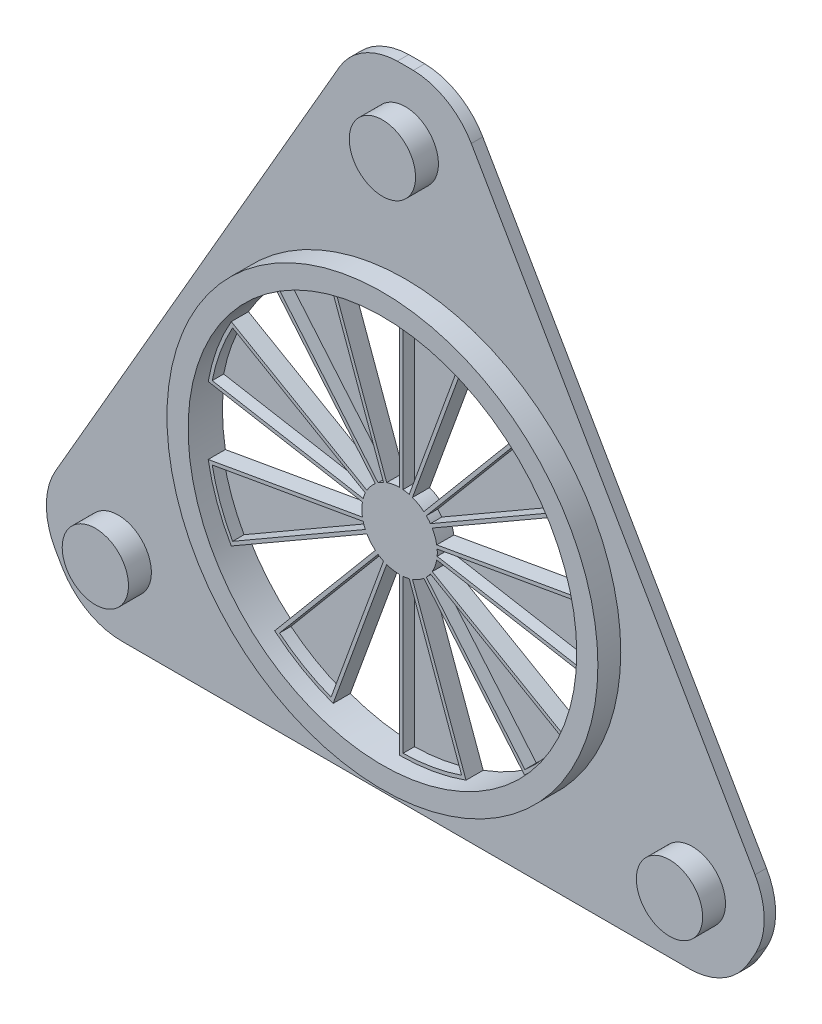
from build123d import *
from build123d.topology import SkipClean

# Parameters (mm, degrees)
SKETCH2_R           = 18.85
BOSS_EXTRUDE1_DEPTH = 3
BOSS_EXTRUDE7_START = -0.5
BOSS_EXTRUDE7_DEPTH = 0.5
BOSS_EXTRUDE9_START = -2
SKETCH17_R          = 3.3
BOSS_EXTRUDE9_DEPTH = 2
SKETCH9_R           = 3.098061326
BOSS_EXTRUDE5_DEPTH = 3
BOSS_EXTRUDE2_START = -1
SKETCH3_R           = 35
SKETCH3_R_2         = 18.85
BOSS_EXTRUDE2_DEPTH = 1
SKETCH4_R           = 2.9
BOSS_EXTRUDE3_DEPTH = 3
SKETCH6_R           = 5
BOSS_EXTRUDE4_DEPTH = 1
SKETCH7_R           = 59.131365533
CUT_EXTRUDE1_DEPTH  = 10
FILLET1_R           = 6
SKETCH19_R          = 17
CUT_EXTRUDE3_DEPTH  = 1.5


with BuildPart() as part:
    # Sketch2 → Boss-Extrude1 (new body)
    # profile 1 of 37: a face of its own
    with BuildSketch(Plane.XY.offset(10)):
        Circle(SKETCH2_R)
        with BuildLine():
            ThreePointArc((-5.814342437, 15.974774553), (-2.95201902, 16.741731801), (0, 17))
            ThreePointArc((0, 17), (2.95201902, 16.741731801), (5.814342437, 15.974774553))
            ThreePointArc((5.814342437, 15.974774553), (8.5, 14.722431864), (10.927389365, 13.022755533))
            ThreePointArc((10.927389365, 13.022755533), (13.022755533, 10.927389365), (14.722431864, 8.5))
            ThreePointArc((14.722431864, 8.5), (15.974774553, 5.814342437), (16.741731801, 2.95201902))
            ThreePointArc((16.741731801, 2.95201902), (16.935309868, 1.481647627), (17, 0))
            ThreePointArc((17, 0), (16.935309868, -1.481647627), (16.741731801, -2.95201902))
            ThreePointArc((16.741731801, -2.95201902), (15.974774553, -5.814342437), (14.722431864, -8.5))
            ThreePointArc((14.722431864, -8.5), (13.022755533, -10.927389365), (10.927389365, -13.022755533))
            ThreePointArc((10.927389365, -13.022755533), (8.5, -14.722431864), (5.814342437, -15.974774553))
            ThreePointArc((5.814342437, -15.974774553), (2.95201902, -16.741731801), (0, -17))
            ThreePointArc((0, -17), (-2.95201902, -16.741731801), (-5.814342437, -15.974774553))
            ThreePointArc((-5.814342437, -15.974774553), (-8.5, -14.722431864), (-10.927389365, -13.022755533))
            ThreePointArc((-10.927389365, -13.022755533), (-13.022755533, -10.927389365), (-14.722431864, -8.5))
            ThreePointArc((-14.722431864, -8.5), (-15.974774553, -5.814342437), (-16.741731801, -2.95201902))
            ThreePointArc((-16.741731801, -2.95201902), (-17, 0), (-16.741731801, 2.95201902))
            ThreePointArc((-16.741731801, 2.95201902), (-15.974774553, 5.814342437), (-14.722431864, 8.5))
            ThreePointArc((-14.722431864, 8.5), (-13.022755533, 10.927389365), (-10.927389365, 13.022755533))
            ThreePointArc((-10.927389365, 13.022755533), (-8.5, 14.722431864), (-5.814342437, 15.974774553))
        make_face(mode=Mode.SUBTRACT)
    # profile 2 of 37: a face of its own
    with BuildSketch(Plane.XY.offset(10)):
        with BuildLine():
            Line((0, 17), (0, 16.697537549))
            ThreePointArc((0, 16.697537549), (0.150006053, 16.696863729), (0.3, 16.694842323))
            ThreePointArc((0.3, 16.694842323), (2.899496967, 16.443864434), (5.428064578, 15.790626179))
            ThreePointArc((5.428064578, 15.790626179), (5.569704144, 15.741224728), (5.710894186, 15.69055282))
            Line((5.710894186, 15.69055282), (5.814342437, 15.974774553))
            ThreePointArc((5.814342437, 15.974774553), (2.95201902, 16.741731801), (0, 17))
        make_face()
    # profile 3 of 37: a face of its own
    with BuildSketch(Plane.XY.offset(10)):
        with BuildLine():
            ThreePointArc((-5.99188015, 15.585414093), (-5.851623307, 15.638614544), (-5.710894186, 15.69055282))
            Line((-5.710894186, 15.69055282), (-5.814342437, 15.974774553))
            ThreePointArc((-5.814342437, 15.974774553), (-8.5, 14.722431864), (-10.927389365, 13.022755533))
            Line((-10.927389365, 13.022755533), (-10.732970249, 12.791055853))
            ThreePointArc((-10.732970249, 12.791055853), (-10.617625822, 12.886961709), (-10.501424458, 12.981827473))
            ThreePointArc((-10.501424458, 12.981827473), (-8.348768774, 14.460491698), (-5.99188015, 15.585414093))
        make_face()
    # profile 4 of 37: a face of its own
    with BuildSketch(Plane.XY.offset(10)):
        with BuildLine():
            ThreePointArc((-14.608157564, 8.08761354), (-14.534911179, 8.218522811), (-14.460491698, 8.348768774))
            Line((-14.460491698, 8.348768774), (-14.722431864, 8.5))
            ThreePointArc((-14.722431864, 8.5), (-15.974774553, 5.814342437), (-16.741731801, 2.95201902))
            Line((-16.741731801, 2.95201902), (-16.443864434, 2.899496967))
            ThreePointArc((-16.443864434, 2.899496967), (-16.417152573, 3.047107084), (-16.389115702, 3.194471272))
            ThreePointArc((-16.389115702, 3.194471272), (-15.69055282, 5.710894186), (-14.608157564, 8.08761354))
        make_face()
    # profile 5 of 37: a face of its own
    with BuildSketch(Plane.XY.offset(10)):
        with BuildLine():
            ThreePointArc((-16.389115702, -3.194471272), (-16.417152573, -3.047107084), (-16.443864434, -2.899496967))
            Line((-16.443864434, -2.899496967), (-16.741731801, -2.95201902))
            ThreePointArc((-16.741731801, -2.95201902), (-15.974774553, -5.814342437), (-14.722431864, -8.5))
            Line((-14.722431864, -8.5), (-14.460491698, -8.348768774))
            ThreePointArc((-14.460491698, -8.348768774), (-14.534911179, -8.218522811), (-14.608157564, -8.08761354))
            ThreePointArc((-14.608157564, -8.08761354), (-15.69055282, -5.710894186), (-16.389115702, -3.194471272))
        make_face()
    # profile 6 of 37: a face of its own
    with BuildSketch(Plane.XY.offset(10)):
        with BuildLine():
            ThreePointArc((-10.501424458, -12.981827473), (-10.617625822, -12.886961709), (-10.732970249, -12.791055853))
            Line((-10.732970249, -12.791055853), (-10.927389365, -13.022755533))
            ThreePointArc((-10.927389365, -13.022755533), (-8.5, -14.722431864), (-5.814342437, -15.974774553))
            Line((-5.814342437, -15.974774553), (-5.710894186, -15.69055282))
            ThreePointArc((-5.710894186, -15.69055282), (-5.851623307, -15.638614544), (-5.99188015, -15.585414093))
            ThreePointArc((-5.99188015, -15.585414093), (-8.348768774, -14.460491698), (-10.501424458, -12.981827473))
        make_face()
    # profile 7 of 37: a face of its own
    with BuildSketch(Plane.XY.offset(10)):
        with BuildLine():
            Line((5.814342437, -15.974774553), (5.710894186, -15.69055282))
            ThreePointArc((5.710894186, -15.69055282), (5.569704144, -15.741224728), (5.428064578, -15.790626179))
            ThreePointArc((5.428064578, -15.790626179), (2.899496967, -16.443864434), (0.3, -16.694842323))
            ThreePointArc((0.3, -16.694842323), (0.150006053, -16.696863729), (0, -16.697537549))
            Line((0, -16.697537549), (0, -17))
            ThreePointArc((0, -17), (2.95201902, -16.741731801), (5.814342437, -15.974774553))
        make_face()
    # profile 8 of 37: a face of its own
    with BuildSketch(Plane.XY.offset(10)):
        with BuildLine():
            Line((14.722431864, -8.5), (14.460491698, -8.348768774))
            ThreePointArc((14.460491698, -8.348768774), (14.384905126, -8.478340917), (14.308157564, -8.607228783))
            ThreePointArc((14.308157564, -8.607228783), (12.791055853, -10.732970249), (10.961051124, -12.596154907))
            ThreePointArc((10.961051124, -12.596154907), (10.847448429, -12.694117644), (10.732970249, -12.791055853))
            Line((10.732970249, -12.791055853), (10.927389365, -13.022755533))
            ThreePointArc((10.927389365, -13.022755533), (13.022755533, -10.927389365), (14.722431864, -8.5))
        make_face()
    # profile 9 of 37: a face of its own
    with BuildSketch(Plane.XY.offset(10)):
        with BuildLine():
            ThreePointArc((0.842085099, 3.190751116), (0.986397435, 3.149130054), (1.128666473, 3.100985649))
            Line((1.128666473, 3.100985649), (5.710894186, 15.69055282))
            ThreePointArc((5.710894186, 15.69055282), (5.569704144, 15.741224728), (5.428064578, 15.790626179))
            Line((5.428064578, 15.790626179), (0.842085099, 3.190751116))
        make_face()
    # profile 10 of 37: a face of its own
    with BuildSketch(Plane.XY.offset(10)):
        with BuildLine():
            Line((0, 16.697537549), (0, 3.3))
            ThreePointArc((0, 3.3), (0.150155522, 3.296582066), (0.3, 3.286335345))
            Line((0.3, 3.286335345), (0.3, 16.694842323))
            ThreePointArc((0.3, 16.694842323), (0.150006053, 16.696863729), (0, 16.697537549))
        make_face()
    # profile 11 of 37: a face of its own
    with BuildSketch(Plane.XY.offset(10)):
        with BuildLine():
            ThreePointArc((-1.405900672, 2.98553903), (-1.268597506, 3.046417628), (-1.128666473, 3.100985649))
            Line((-1.128666473, 3.100985649), (-5.710894186, 15.69055282))
            ThreePointArc((-5.710894186, 15.69055282), (-5.851623307, 15.638614544), (-5.99188015, 15.585414093))
            Line((-5.99188015, 15.585414093), (-1.405900672, 2.98553903))
        make_face()
    # profile 12 of 37: a face of its own
    with BuildSketch(Plane.XY.offset(10)):
        with BuildLine():
            Line((-10.732970249, 12.791055853), (-2.121199112, 2.527946662))
            ThreePointArc((-2.121199112, 2.527946662), (-2.003976303, 2.621846482), (-1.882602308, 2.710315212))
            Line((-1.882602308, 2.710315212), (-10.501424458, 12.981827473))
            ThreePointArc((-10.501424458, 12.981827473), (-10.617625822, 12.886961709), (-10.732970249, 12.791055853))
        make_face()
    # profile 13 of 37: a face of its own
    with BuildSketch(Plane.XY.offset(10)):
        with BuildLine():
            ThreePointArc((-2.996049894, 1.383360051), (-2.930001576, 1.518252537), (-2.857883832, 1.65))
            Line((-2.857883832, 1.65), (-14.460491698, 8.348768774))
            ThreePointArc((-14.460491698, 8.348768774), (-14.534911179, 8.218522811), (-14.608157564, 8.08761354))
            Line((-14.608157564, 8.08761354), (-2.996049894, 1.383360051))
        make_face()
    # profile 14 of 37: a face of its own
    with BuildSketch(Plane.XY.offset(10)):
        with BuildLine():
            Line((-16.443864434, 2.899496967), (-3.249865585, 0.573038986))
            ThreePointArc((-3.249865585, 0.573038986), (-3.220425345, 0.72031979), (-3.184314073, 0.86610847))
            Line((-3.184314073, 0.86610847), (-16.389115702, 3.194471272))
            ThreePointArc((-16.389115702, 3.194471272), (-16.417152573, 3.047107084), (-16.443864434, 2.899496967))
        make_face()
    # profile 15 of 37: a face of its own
    with BuildSketch(Plane.XY.offset(10)):
        with BuildLine():
            ThreePointArc((-3.184314073, -0.86610847), (-3.220425345, -0.72031979), (-3.249865585, -0.573038986))
            Line((-3.249865585, -0.573038986), (-16.443864434, -2.899496967))
            ThreePointArc((-16.443864434, -2.899496967), (-16.417152573, -3.047107084), (-16.389115702, -3.194471272))
            Line((-16.389115702, -3.194471272), (-3.184314073, -0.86610847))
        make_face()
    # profile 16 of 37: a face of its own
    with BuildSketch(Plane.XY.offset(10)):
        with BuildLine():
            Line((-14.460491698, -8.348768774), (-2.857883832, -1.65))
            ThreePointArc((-2.857883832, -1.65), (-2.930001576, -1.518252537), (-2.996049894, -1.383360051))
            Line((-2.996049894, -1.383360051), (-14.608157564, -8.08761354))
            ThreePointArc((-14.608157564, -8.08761354), (-14.534911179, -8.218522811), (-14.460491698, -8.348768774))
        make_face()
    # profile 17 of 37: a face of its own
    with BuildSketch(Plane.XY.offset(10)):
        with BuildLine():
            ThreePointArc((-1.882602308, -2.710315212), (-2.003976303, -2.621846482), (-2.121199112, -2.527946662))
            Line((-2.121199112, -2.527946662), (-10.732970249, -12.791055853))
            ThreePointArc((-10.732970249, -12.791055853), (-10.617625822, -12.886961709), (-10.501424458, -12.981827473))
            Line((-10.501424458, -12.981827473), (-1.882602308, -2.710315212))
        make_face()
    # profile 18 of 37: a face of its own
    with BuildSketch(Plane.XY.offset(10)):
        with BuildLine():
            Line((-5.710894186, -15.69055282), (-1.128666473, -3.100985649))
            ThreePointArc((-1.128666473, -3.100985649), (-1.268597506, -3.046417628), (-1.405900672, -2.98553903))
            Line((-1.405900672, -2.98553903), (-5.99188015, -15.585414093))
            ThreePointArc((-5.99188015, -15.585414093), (-5.851623307, -15.638614544), (-5.710894186, -15.69055282))
        make_face()
    # profile 19 of 37: a face of its own
    with BuildSketch(Plane.XY.offset(10)):
        with BuildLine():
            ThreePointArc((0.3, -3.286335345), (0.150155522, -3.296582066), (0, -3.3))
            Line((0, -3.3), (0, -16.697537549))
            ThreePointArc((0, -16.697537549), (0.150006053, -16.696863729), (0.3, -16.694842323))
            Line((0.3, -16.694842323), (0.3, -3.286335345))
        make_face()
    # profile 20 of 37: a face of its own
    with BuildSketch(Plane.XY.offset(10)):
        with BuildLine():
            Line((5.710894186, -15.69055282), (1.128666473, -3.100985649))
            ThreePointArc((1.128666473, -3.100985649), (0.986397435, -3.149130054), (0.842085099, -3.190751116))
            Line((0.842085099, -3.190751116), (5.428064578, -15.790626179))
            ThreePointArc((5.428064578, -15.790626179), (5.569704144, -15.741224728), (5.710894186, -15.69055282))
        make_face()
    # profile 21 of 37: a face of its own
    with BuildSketch(Plane.XY.offset(10)):
        with BuildLine():
            ThreePointArc((2.342228974, -2.324642646), (2.234027909, -2.428810264), (2.121199112, -2.527946662))
            Line((2.121199112, -2.527946662), (10.732970249, -12.791055853))
            ThreePointArc((10.732970249, -12.791055853), (10.847448429, -12.694117644), (10.961051124, -12.596154907))
            Line((10.961051124, -12.596154907), (2.342228974, -2.324642646))
        make_face()
    # profile 22 of 37: a face of its own
    with BuildSketch(Plane.XY.offset(10)):
        with BuildLine():
            Line((14.460491698, -8.348768774), (2.857883832, -1.65))
            ThreePointArc((2.857883832, -1.65), (2.779846054, -1.778329529), (2.696049894, -1.902975294))
            Line((2.696049894, -1.902975294), (14.308157564, -8.607228783))
            ThreePointArc((14.308157564, -8.607228783), (14.384905126, -8.478340917), (14.460491698, -8.348768774))
        make_face()
    # profile 23 of 37: a face of its own
    with BuildSketch(Plane.XY.offset(10)):
        with BuildLine():
            Line((0, 3.3), (0, 2.988310559))
            ThreePointArc((0, 2.988310559), (0.518914683, 2.942911407), (1.022062406, 2.808093381))
            Line((1.022062406, 2.808093381), (1.128666473, 3.100985649))
            ThreePointArc((1.128666473, 3.100985649), (0.986397435, 3.149130054), (0.842085099, 3.190751116))
            ThreePointArc((0.842085099, 3.190751116), (0.573038986, 3.249865585), (0.3, 3.286335345))
            ThreePointArc((0.3, 3.286335345), (0.150155522, 3.296582066), (0, 3.3))
        make_face()
    # profile 24 of 37: a face of its own
    with BuildSketch(Plane.XY.offset(10)):
        with BuildLine():
            ThreePointArc((-1.920849002, 2.289178698), (-1.49415528, 2.587952859), (-1.022062406, 2.808093381))
            Line((-1.022062406, 2.808093381), (-1.128666473, 3.100985649))
            ThreePointArc((-1.128666473, 3.100985649), (-1.268597506, 3.046417628), (-1.405900672, 2.98553903))
            ThreePointArc((-1.405900672, 2.98553903), (-1.65, 2.857883832), (-1.882602308, 2.710315212))
            ThreePointArc((-1.882602308, 2.710315212), (-2.003976303, 2.621846482), (-2.121199112, 2.527946662))
            Line((-2.121199112, 2.527946662), (-1.920849002, 2.289178698))
        make_face()
    # profile 25 of 37: a face of its own
    with BuildSketch(Plane.XY.offset(10)):
        with BuildLine():
            ThreePointArc((-2.942911407, 0.518914683), (-2.808093381, 1.022062406), (-2.587952859, 1.49415528))
            Line((-2.587952859, 1.49415528), (-2.857883832, 1.65))
            ThreePointArc((-2.857883832, 1.65), (-2.930001576, 1.518252537), (-2.996049894, 1.383360051))
            ThreePointArc((-2.996049894, 1.383360051), (-3.100985649, 1.128666473), (-3.184314073, 0.86610847))
            ThreePointArc((-3.184314073, 0.86610847), (-3.220425345, 0.72031979), (-3.249865585, 0.573038986))
            Line((-3.249865585, 0.573038986), (-2.942911407, 0.518914683))
        make_face()
    # profile 26 of 37: a face of its own
    with BuildSketch(Plane.XY.offset(10)):
        with BuildLine():
            ThreePointArc((-2.587952859, -1.49415528), (-2.808093381, -1.022062406), (-2.942911407, -0.518914683))
            Line((-2.942911407, -0.518914683), (-3.249865585, -0.573038986))
            ThreePointArc((-3.249865585, -0.573038986), (-3.220425345, -0.72031979), (-3.184314073, -0.86610847))
            ThreePointArc((-3.184314073, -0.86610847), (-3.100985649, -1.128666473), (-2.996049894, -1.383360051))
            ThreePointArc((-2.996049894, -1.383360051), (-2.930001576, -1.518252537), (-2.857883832, -1.65))
            Line((-2.857883832, -1.65), (-2.587952859, -1.49415528))
        make_face()
    # profile 27 of 37: a face of its own
    with BuildSketch(Plane.XY.offset(10)):
        with BuildLine():
            ThreePointArc((-1.022062406, -2.808093381), (-1.49415528, -2.587952859), (-1.920849002, -2.289178698))
            Line((-1.920849002, -2.289178698), (-2.121199112, -2.527946662))
            ThreePointArc((-2.121199112, -2.527946662), (-2.003976303, -2.621846482), (-1.882602308, -2.710315212))
            ThreePointArc((-1.882602308, -2.710315212), (-1.65, -2.857883832), (-1.405900672, -2.98553903))
            ThreePointArc((-1.405900672, -2.98553903), (-1.268597506, -3.046417628), (-1.128666473, -3.100985649))
            Line((-1.128666473, -3.100985649), (-1.022062406, -2.808093381))
        make_face()
    # profile 28 of 37: a face of its own
    with BuildSketch(Plane.XY.offset(10)):
        with BuildLine():
            Line((1.128666473, -3.100985649), (1.022062406, -2.808093381))
            ThreePointArc((1.022062406, -2.808093381), (0.518914683, -2.942911407), (0, -2.988310559))
            Line((0, -2.988310559), (0, -3.3))
            ThreePointArc((0, -3.3), (0.150155522, -3.296582066), (0.3, -3.286335345))
            ThreePointArc((0.3, -3.286335345), (0.573038986, -3.249865585), (0.842085099, -3.190751116))
            ThreePointArc((0.842085099, -3.190751116), (0.986397435, -3.149130054), (1.128666473, -3.100985649))
        make_face()
    # profile 29 of 37: a face of its own
    with BuildSketch(Plane.XY.offset(10)):
        with BuildLine():
            Line((2.857883832, -1.65), (2.587952859, -1.49415528))
            ThreePointArc((2.587952859, -1.49415528), (2.289178698, -1.920849002), (1.920849002, -2.289178698))
            Line((1.920849002, -2.289178698), (2.121199112, -2.527946662))
            ThreePointArc((2.121199112, -2.527946662), (2.234027909, -2.428810264), (2.342228974, -2.324642646))
            ThreePointArc((2.342228974, -2.324642646), (2.527946662, -2.121199112), (2.696049894, -1.902975294))
            ThreePointArc((2.696049894, -1.902975294), (2.779846054, -1.778329529), (2.857883832, -1.65))
        make_face()
    # profile 30 of 37: a face of its own
    with BuildSketch(Plane.XY.offset(10)):
        with BuildLine():
            Line((3.249865585, 0.573038986), (2.942911407, 0.518914683))
            ThreePointArc((2.942911407, 0.518914683), (2.976939136, 0.260448426), (2.988310559, 0))
            ThreePointArc((2.988310559, 0), (2.976939136, -0.260448426), (2.942911407, -0.518914683))
            Line((2.942911407, -0.518914683), (3.249865585, -0.573038986))
            ThreePointArc((3.249865585, -0.573038986), (3.27257381, -0.424571146), (3.28850298, -0.275223818))
            ThreePointArc((3.28850298, -0.275223818), (3.297124492, -0.137731924), (3.3, 0))
            ThreePointArc((3.3, 0), (3.297124492, 0.137731924), (3.28850298, 0.275223818))
            ThreePointArc((3.28850298, 0.275223818), (3.27257381, 0.424571146), (3.249865585, 0.573038986))
        make_face()
    # profile 31 of 37: a face of its own
    with BuildSketch(Plane.XY.offset(10)):
        with BuildLine():
            ThreePointArc((3.28850298, -0.275223818), (3.27257381, -0.424571146), (3.249865585, -0.573038986))
            Line((3.249865585, -0.573038986), (16.443864434, -2.899496967))
            ThreePointArc((16.443864434, -2.899496967), (16.469249129, -2.751652835), (16.493304608, -2.60358662))
            Line((16.493304608, -2.60358662), (3.28850298, -0.275223818))
        make_face()
    # profile 32 of 37: a face of its own
    with BuildSketch(Plane.XY.offset(10)):
        with BuildLine():
            Line((16.443864434, 2.899496967), (3.249865585, 0.573038986))
            ThreePointArc((3.249865585, 0.573038986), (3.27257381, 0.424571146), (3.28850298, 0.275223818))
            Line((3.28850298, 0.275223818), (16.493304608, 2.60358662))
            ThreePointArc((16.493304608, 2.60358662), (16.469249129, 2.751652835), (16.443864434, 2.899496967))
        make_face()
    # profile 33 of 37: a face of its own
    with BuildSketch(Plane.XY.offset(10)):
        with BuildLine():
            Line((16.741731801, 2.95201902), (16.443864434, 2.899496967))
            ThreePointArc((16.443864434, 2.899496967), (16.469249129, 2.751652835), (16.493304608, 2.60358662))
            ThreePointArc((16.493304608, 2.60358662), (16.64640101, 1.305792325), (16.697537549, 0))
            ThreePointArc((16.697537549, 0), (16.64640101, -1.305792325), (16.493304608, -2.60358662))
            ThreePointArc((16.493304608, -2.60358662), (16.469249129, -2.751652835), (16.443864434, -2.899496967))
            Line((16.443864434, -2.899496967), (16.741731801, -2.95201902))
            ThreePointArc((16.741731801, -2.95201902), (16.935309868, -1.481647627), (17, 0))
            ThreePointArc((17, 0), (16.935309868, 1.481647627), (16.741731801, 2.95201902))
        make_face()
    # profile 34 of 37: a face of its own
    with BuildSketch(Plane.XY.offset(10)):
        with BuildLine():
            Line((2.121199112, 2.527946662), (1.920849002, 2.289178698))
            ThreePointArc((1.920849002, 2.289178698), (2.289178698, 1.920849002), (2.587952859, 1.49415528))
            Line((2.587952859, 1.49415528), (2.857883832, 1.65))
            ThreePointArc((2.857883832, 1.65), (2.779846054, 1.778329529), (2.696049894, 1.902975294))
            ThreePointArc((2.696049894, 1.902975294), (2.527946662, 2.121199112), (2.342228974, 2.324642646))
            ThreePointArc((2.342228974, 2.324642646), (2.234027909, 2.428810264), (2.121199112, 2.527946662))
        make_face()
    # profile 35 of 37: a face of its own
    with BuildSketch(Plane.XY.offset(10)):
        with BuildLine():
            ThreePointArc((2.696049894, 1.902975294), (2.779846054, 1.778329529), (2.857883832, 1.65))
            Line((2.857883832, 1.65), (14.460491698, 8.348768774))
            ThreePointArc((14.460491698, 8.348768774), (14.384905126, 8.478340917), (14.308157564, 8.607228783))
            Line((14.308157564, 8.607228783), (2.696049894, 1.902975294))
        make_face()
    # profile 36 of 37: a face of its own
    with BuildSketch(Plane.XY.offset(10)):
        with BuildLine():
            Line((10.732970249, 12.791055853), (2.121199112, 2.527946662))
            ThreePointArc((2.121199112, 2.527946662), (2.234027909, 2.428810264), (2.342228974, 2.324642646))
            Line((2.342228974, 2.324642646), (10.961051124, 12.596154907))
            ThreePointArc((10.961051124, 12.596154907), (10.847448429, 12.694117644), (10.732970249, 12.791055853))
        make_face()
    # profile 37 of 37: a face of its own
    with BuildSketch(Plane.XY.offset(10)):
        with BuildLine():
            Line((10.927389365, 13.022755533), (10.732970249, 12.791055853))
            ThreePointArc((10.732970249, 12.791055853), (10.847448429, 12.694117644), (10.961051124, 12.596154907))
            ThreePointArc((10.961051124, 12.596154907), (12.791055853, 10.732970249), (14.308157564, 8.607228783))
            ThreePointArc((14.308157564, 8.607228783), (14.384905126, 8.478340917), (14.460491698, 8.348768774))
            Line((14.460491698, 8.348768774), (14.722431864, 8.5))
            ThreePointArc((14.722431864, 8.5), (13.022755533, 10.927389365), (10.927389365, 13.022755533))
        make_face()
    extrude(amount=-BOSS_EXTRUDE1_DEPTH)

    # Sketch11 → Boss-Extrude7 (add)
    with SkipClean():  # the faces are left unmerged after this step: merging them gives an invalid solid
        with BuildSketch(Plane(origin=(0, 0, 7), x_dir=(-1, 0, 0), z_dir=(0, 0, -1)).offset(BOSS_EXTRUDE7_START)):
            with BuildLine():
                ThreePointArc((-1.022062406, 2.808093381), (-0.518914683, 2.942911407), (0, 2.988310559))
                Line((0, 2.988310559), (0, 18.85))
                ThreePointArc((0, 18.85), (-3.273268149, 18.563626144), (-6.447079702, 17.713205902))
                Line((-6.447079702, 17.713205902), (-1.022062406, 2.808093381))
            make_face()
            with BuildLine():
                ThreePointArc((-2.587952859, 1.49415528), (-2.289178698, 1.920849002), (-1.920849002, 2.289178698))
                Line((-1.920849002, 2.289178698), (-12.116546443, 14.439937753))
                ThreePointArc((-12.116546443, 14.439937753), (-14.439937753, 12.116546443), (-16.324578861, 9.425))
                Line((-16.324578861, 9.425), (-2.587952859, 1.49415528))
            make_face()
            with BuildLine():
                ThreePointArc((-2.942911407, -0.518914683), (-2.988310559, 0), (-2.942911407, 0.518914683))
                Line((-2.942911407, 0.518914683), (-18.563626144, 3.273268149))
                ThreePointArc((-18.563626144, 3.273268149), (-18.85, 0), (-18.563626144, -3.273268149))
                Line((-18.563626144, -3.273268149), (-2.942911407, -0.518914683))
            make_face()
            with BuildLine():
                ThreePointArc((-1.920849002, -2.289178698), (-2.289178698, -1.920849002), (-2.587952859, -1.49415528))
                Line((-2.587952859, -1.49415528), (-16.324578861, -9.425))
                ThreePointArc((-16.324578861, -9.425), (-14.439937753, -12.116546443), (-12.116546443, -14.439937753))
                Line((-12.116546443, -14.439937753), (-1.920849002, -2.289178698))
            make_face()
            with BuildLine():
                ThreePointArc((0, -2.988310559), (-0.518914683, -2.942911407), (-1.022062406, -2.808093381))
                Line((-1.022062406, -2.808093381), (-6.447079702, -17.713205902))
                ThreePointArc((-6.447079702, -17.713205902), (-3.273268149, -18.563626144), (0, -18.85))
                Line((0, -18.85), (0, -2.988310559))
            make_face()
            with BuildLine():
                Line((12.116546443, -14.439937753), (1.920849002, -2.289178698))
                ThreePointArc((1.920849002, -2.289178698), (1.49415528, -2.587952859), (1.022062406, -2.808093381))
                Line((1.022062406, -2.808093381), (6.447079702, -17.713205902))
                ThreePointArc((6.447079702, -17.713205902), (9.425, -16.324578861), (12.116546443, -14.439937753))
            make_face()
            with BuildLine():
                Line((18.563626144, -3.273268149), (2.942911407, -0.518914683))
                ThreePointArc((2.942911407, -0.518914683), (2.808093381, -1.022062406), (2.587952859, -1.49415528))
                Line((2.587952859, -1.49415528), (16.324578861, -9.425))
                ThreePointArc((16.324578861, -9.425), (17.713205902, -6.447079702), (18.563626144, -3.273268149))
            make_face()
            with BuildLine():
                Line((16.324578861, 9.425), (2.587952859, 1.49415528))
                ThreePointArc((2.587952859, 1.49415528), (2.808093381, 1.022062406), (2.942911407, 0.518914683))
                Line((2.942911407, 0.518914683), (18.563626144, 3.273268149))
                ThreePointArc((18.563626144, 3.273268149), (17.713205902, 6.447079702), (16.324578861, 9.425))
            make_face()
            with BuildLine():
                Line((6.447079702, 17.713205902), (1.022062406, 2.808093381))
                ThreePointArc((1.022062406, 2.808093381), (1.49415528, 2.587952859), (1.920849002, 2.289178698))
                Line((1.920849002, 2.289178698), (12.116546443, 14.439937753))
                ThreePointArc((12.116546443, 14.439937753), (9.425, 16.324578861), (6.447079702, 17.713205902))
            make_face()
        extrude(amount=BOSS_EXTRUDE7_DEPTH)

    # Sketch17 → Boss-Extrude9 (add)
    with SkipClean():  # the faces are left unmerged after this step: merging them gives an invalid solid
        with BuildSketch(Plane(origin=(0, 0, 7), x_dir=(-1, 0, 0), z_dir=(0, 0, -1)).offset(BOSS_EXTRUDE9_START)):
            Circle(SKETCH17_R)
        extrude(amount=BOSS_EXTRUDE9_DEPTH)

    # Sketch9 → Boss-Extrude5 (add)
    with SkipClean():  # the faces are left unmerged after this step: merging them gives an invalid solid
        with BuildSketch(Plane.XY.offset(10)):
            Circle(SKETCH9_R)
        extrude(amount=-BOSS_EXTRUDE5_DEPTH)

    # Sketch3 → Boss-Extrude2 (add)
    with BuildSketch(Plane(origin=(0, 0, 7), x_dir=(-1, 0, 0), z_dir=(0, 0, -1)).offset(BOSS_EXTRUDE2_START)):
        Circle(SKETCH3_R)
        with Locations(Location((0, 0, 0), (0, 0, 180))):
            Circle(SKETCH3_R_2, mode=Mode.SUBTRACT)
    extrude(amount=BOSS_EXTRUDE2_DEPTH)

    # Sketch4 → Boss-Extrude3 (add)
    with BuildSketch(Plane(origin=(0, 0, 7), x_dir=(-1, 0, 0), z_dir=(0, 0, -1))):
        with Locations((0, 29)):
            Circle(SKETCH4_R)
        with Locations((25.11473671, -14.5)):
            Circle(SKETCH4_R)
        with Locations((-25.11473671, -14.5)):
            Circle(SKETCH4_R)
    extrude(amount=-BOSS_EXTRUDE3_DEPTH)

    # Sketch6 → Boss-Extrude4 (add)
    with BuildSketch(Plane(origin=(0, 0, 8), x_dir=(-1, 0, 0), z_dir=(0, 0, -1))):
        with Locations((0, 30)):
            Circle(SKETCH6_R)
        with Locations((25.980762114, -15)):
            Circle(SKETCH6_R)
        with Locations((-25.980762114, -15)):
            Circle(SKETCH6_R)
    extrude(amount=BOSS_EXTRUDE4_DEPTH)

    # Sketch7 → Cut-Extrude1 (cut)
    with BuildSketch(Plane(origin=(0, 0, 7), x_dir=(-1, 0, 0), z_dir=(0, 0, -1))):
        Circle(SKETCH7_R)
        Polygon((0, 42), (-36.373066959, -21), (36.373066959, -21), align=None, mode=Mode.SUBTRACT)
    extrude(amount=-CUT_EXTRUDE1_DEPTH, mode=Mode.SUBTRACT)

    # Fillet1
    fillet1_edges = [part.edges().sort_by_distance(p)[0] for p in [
        (-4.186533479, 34.748711306, 7.5),
        (-32.186533479, -13.748711306, 7.5),
        (-28, -21, 7.5),
        (28, -21, 7.5),
        (32.186533479, -13.748711306, 7.5),
        (4.186533479, 34.748711306, 7.5),
    ]]
    fillet(fillet1_edges, radius=FILLET1_R)

    # Sketch19 → Cut-Extrude3 (cut)
    with BuildSketch(Plane.XY.offset(10)):
        Circle(SKETCH19_R)
    extrude(amount=-CUT_EXTRUDE3_DEPTH, mode=Mode.SUBTRACT)


solid = part.part
